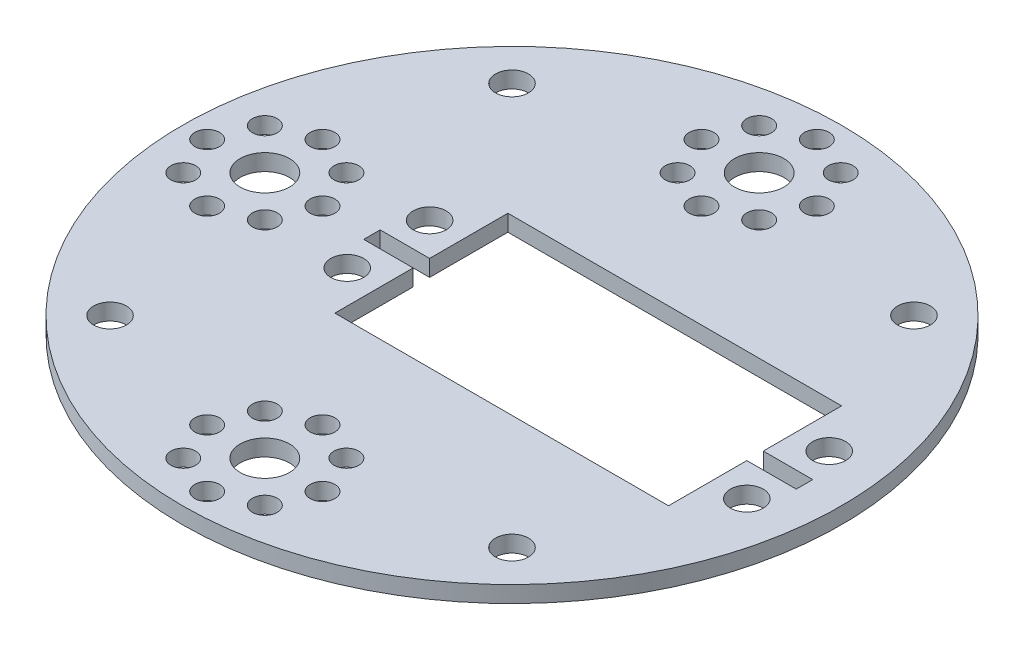
from build123d import *

# Parameters (mm, degrees)
SKETCH_1_R      = 40
SKETCH_1_R_2    = 2
SKETCH_1_R_3    = 3
SKETCH_1_R_4    = 1.5
EXTRUDE_1_DEPTH = 2


with BuildPart() as part:
    # 草图1 → 凸台-拉伸1 (new body)
    with BuildSketch(Plane(origin=(0, 0, 0), x_dir=(1, 0, 0), z_dir=(0, 1, 0))):
        with Locations(Location((0, 0, 0), (0, 0, 270))):
            Circle(SKETCH_1_R)
        with Locations(Location((-24.395, 24.395, 0), (0, 0, 270))):
            Circle(SKETCH_1_R_2, mode=Mode.SUBTRACT)
        with Locations(Location((24.395, 24.395, 0), (0, 0, 270))):
            Circle(SKETCH_1_R_2, mode=Mode.SUBTRACT)
        with Locations(Location((24.395, -24.395, 0), (0, 0, 270))):
            Circle(SKETCH_1_R_2, mode=Mode.SUBTRACT)
        with Locations(Location((-24.395, -24.395, 0), (0, 0, 270))):
            Circle(SKETCH_1_R_2, mode=Mode.SUBTRACT)
        with Locations(Location((0, -30, 0), (0, 0, 270))):
            Circle(SKETCH_1_R_3, mode=Mode.SUBTRACT)
        with Locations(Location((0, -23, 0), (0, 0, 270))):
            Circle(SKETCH_1_R_4, mode=Mode.SUBTRACT)
        with Locations(Location((4.949747468, -25.050252532, 0), (0, 0, 270))):
            Circle(SKETCH_1_R_4, mode=Mode.SUBTRACT)
        with Locations(Location((7, -30, 0), (0, 0, 270))):
            Circle(SKETCH_1_R_4, mode=Mode.SUBTRACT)
        with Locations(Location((4.949747468, -34.949747468, 0), (0, 0, 270))):
            Circle(SKETCH_1_R_4, mode=Mode.SUBTRACT)
        with Locations(Location((0, -37, 0), (0, 0, 270))):
            Circle(SKETCH_1_R_4, mode=Mode.SUBTRACT)
        with Locations(Location((-4.949747468, -34.949747468, 0), (0, 0, 270))):
            Circle(SKETCH_1_R_4, mode=Mode.SUBTRACT)
        with Locations(Location((-7, -30, 0), (0, 0, 270))):
            Circle(SKETCH_1_R_4, mode=Mode.SUBTRACT)
        with Locations(Location((-4.949747468, -25.050252532, 0), (0, 0, 270))):
            Circle(SKETCH_1_R_4, mode=Mode.SUBTRACT)
        with Locations(Location((0, 30, 0), (0, 0, 270))):
            Circle(SKETCH_1_R_3, mode=Mode.SUBTRACT)
        with Locations(Location((4.949747468, 25.050252532, 0), (0, 0, 270))):
            Circle(SKETCH_1_R_4, mode=Mode.SUBTRACT)
        with Locations(Location((7, 30, 0), (0, 0, 270))):
            Circle(SKETCH_1_R_4, mode=Mode.SUBTRACT)
        with Locations(Location((4.949747468, 34.949747468, 0), (0, 0, 270))):
            Circle(SKETCH_1_R_4, mode=Mode.SUBTRACT)
        with Locations(Location((0, 37, 0), (0, 0, 270))):
            Circle(SKETCH_1_R_4, mode=Mode.SUBTRACT)
        with Locations(Location((-4.949747468, 34.949747468, 0), (0, 0, 270))):
            Circle(SKETCH_1_R_4, mode=Mode.SUBTRACT)
        with Locations(Location((-7, 30, 0), (0, 0, 270))):
            Circle(SKETCH_1_R_4, mode=Mode.SUBTRACT)
        with Locations(Location((-4.949747468, 25.050252532, 0), (0, 0, 270))):
            Circle(SKETCH_1_R_4, mode=Mode.SUBTRACT)
        with Locations(Location((0, 23, 0), (0, 0, 270))):
            Circle(SKETCH_1_R_4, mode=Mode.SUBTRACT)
        with Locations(Location((-30, 0, 0), (0, 0, 270))):
            Circle(SKETCH_1_R_3, mode=Mode.SUBTRACT)
        with Locations(Location((-23, 0, 0), (0, 0, 270))):
            Circle(SKETCH_1_R_4, mode=Mode.SUBTRACT)
        with Locations(Location((-25.050252532, -4.949747468, 0), (0, 0, 270))):
            Circle(SKETCH_1_R_4, mode=Mode.SUBTRACT)
        with Locations(Location((-30, -7, 0), (0, 0, 270))):
            Circle(SKETCH_1_R_4, mode=Mode.SUBTRACT)
        with Locations(Location((-34.949747468, -4.949747468, 0), (0, 0, 270))):
            Circle(SKETCH_1_R_4, mode=Mode.SUBTRACT)
        with Locations(Location((-37, 0, 0), (0, 0, 270))):
            Circle(SKETCH_1_R_4, mode=Mode.SUBTRACT)
        with Locations(Location((-34.949747468, 4.949747468, 0), (0, 0, 270))):
            Circle(SKETCH_1_R_4, mode=Mode.SUBTRACT)
        with Locations(Location((-30, 7, 0), (0, 0, 270))):
            Circle(SKETCH_1_R_4, mode=Mode.SUBTRACT)
        with Locations(Location((-25.050252532, 4.949747468, 0), (0, 0, 270))):
            Circle(SKETCH_1_R_4, mode=Mode.SUBTRACT)
        with Locations(Location((-15, -5, 0), (0, 0, 270))):
            Circle(SKETCH_1_R_2, mode=Mode.SUBTRACT)
        with Locations(Location((33.5, -5, 0), (0, 0, 270))):
            Circle(SKETCH_1_R_2, mode=Mode.SUBTRACT)
        with Locations(Location((33.5, 5, 0), (0, 0, 270))):
            Circle(SKETCH_1_R_2, mode=Mode.SUBTRACT)
        with Locations(Location((-15, 5, 0), (0, 0, 270))):
            Circle(SKETCH_1_R_2, mode=Mode.SUBTRACT)
        Polygon((-11, -1), (-11, -10.5), (29.5, -10.5), (29.5, -1), (35.5, -1), (35.5, 1), (29.5, 1), (29.5, 10.5), (-11, 10.5), (-11, 1), (-17, 1), (-17, -1), align=None, mode=Mode.SUBTRACT)
    extrude(amount=EXTRUDE_1_DEPTH)


solid = part.part
